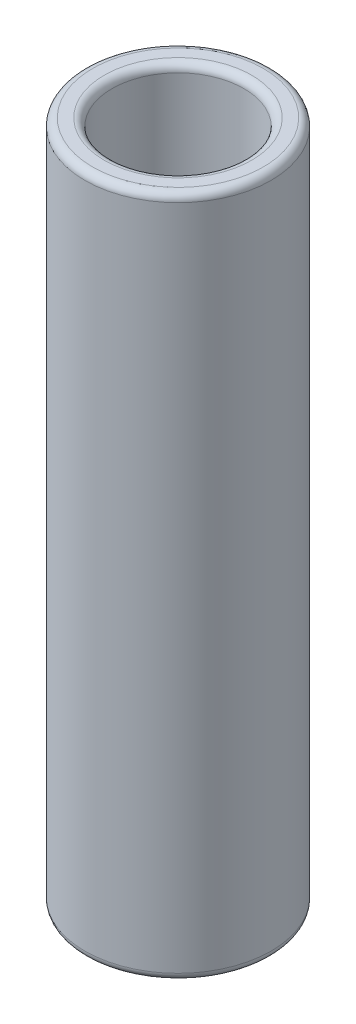
from build123d import *

# Parameters (mm, degrees)
CROQUIS1_R              = 6
CROQUIS1_R_2            = 4.25
SALIENTE_EXTRUIR1_DEPTH = 44
REDONDEO1_R             = 0.5


with BuildPart() as part:
    # Croquis1 → Saliente-Extruir1 (new body)
    with BuildSketch(Plane(origin=(0, 0, 0), x_dir=(1, 0, 0), z_dir=(0, 1, 0))):
        with Locations(Location((0, 0, 0), (0, 0, 270))):
            Circle(CROQUIS1_R)
        with Locations(Location((0, 0, 0), (0, 0, 270))):
            Circle(CROQUIS1_R_2, mode=Mode.SUBTRACT)
    extrude(amount=SALIENTE_EXTRUIR1_DEPTH)

    # Redondeo1
    redondeo1_edges = [part.edges().sort_by_distance(p)[0] for p in [
        (0, 0, -6),
        (0, 44, -6),
        (0, 0, -4.25),
        (0, 44, -4.25),
    ]]
    fillet(redondeo1_edges, radius=REDONDEO1_R)


solid = part.part
